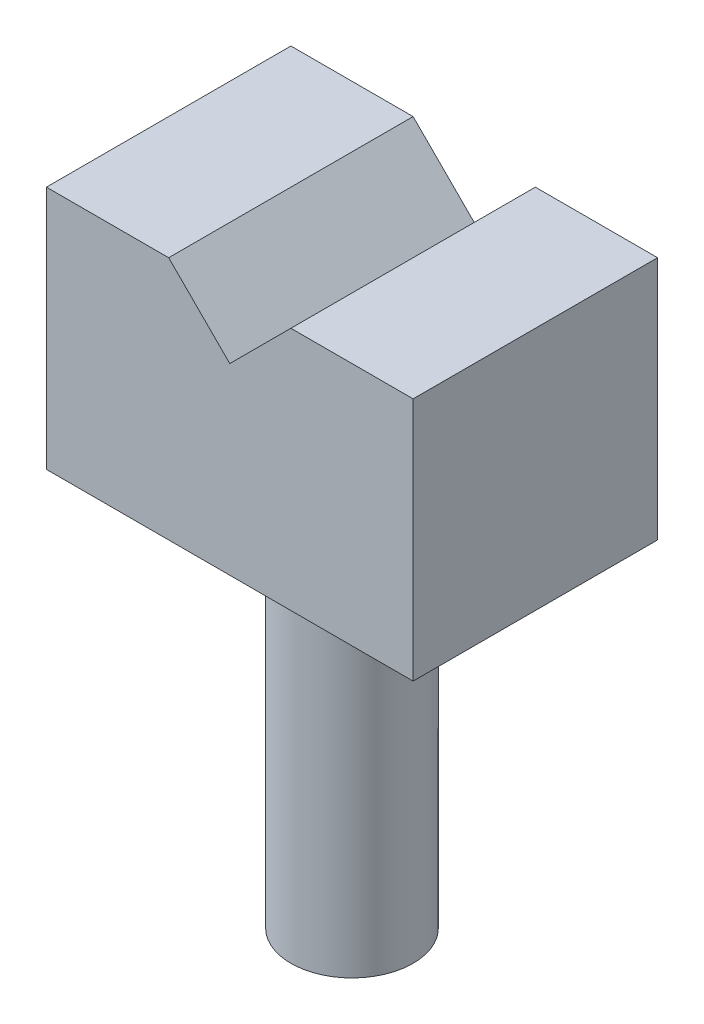
from build123d import *

# Parameters (mm, degrees)
Y_KSEKLIK_EKSTR_ZYON1_DEPTH = 20
IZIM2_R                     = 5
Y_KSEKLIK_EKSTR_ZYON2_DEPTH = 30


with BuildPart() as part:
    # Çizim1 → Yükseklik-Ekstrüzyon1 (new body)
    with BuildSketch(Plane.XY):
        Polygon((30, 0), (0, 0), (0, 20), (10, 20), (15, 15), (20, 20), (30, 20), align=None)
    extrude(amount=Y_KSEKLIK_EKSTR_ZYON1_DEPTH)

    # Çizim2 → Yükseklik-Ekstrüzyon2 (add)
    with BuildSketch(Plane.XZ):
        with Locations(Location((15, 10, 0), (0, 0, 270))):
            Circle(IZIM2_R)
    extrude(amount=Y_KSEKLIK_EKSTR_ZYON2_DEPTH)


solid = part.part
